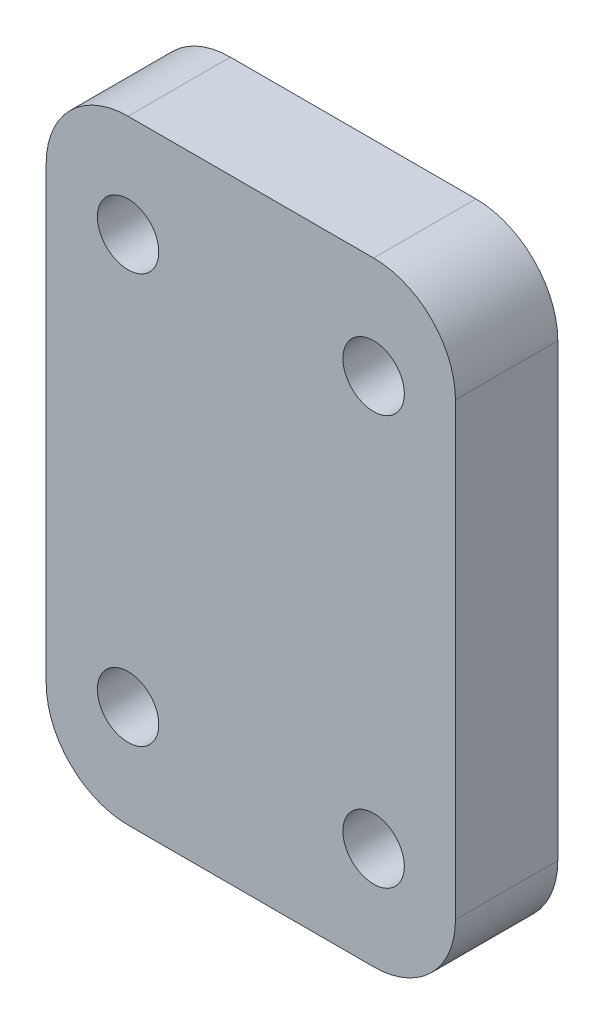
from build123d import *

# Parameters (mm, degrees)
SKETCH1_R           = 1.5
BOSS_EXTRUDE1_DEPTH = 5


with BuildPart() as part:
    # Sketch1 → Boss-Extrude1 (new body)
    with BuildSketch(Plane.XY):
        with BuildLine():
            Line((-6, 15), (6, 15))
            ThreePointArc((6, 15), (8.828427125, 13.828427125), (10, 11))
            Line((10, 11), (10, -11))
            ThreePointArc((10, -11), (8.828427125, -13.828427125), (6, -15))
            Line((6, -15), (-6, -15))
            ThreePointArc((-6, -15), (-8.828427125, -13.828427125), (-10, -11))
            Line((-10, -11), (-10, 11))
            ThreePointArc((-10, 11), (-8.828427125, 13.828427125), (-6, 15))
        make_face()
        with Locations((-6, 10)):
            Circle(SKETCH1_R, mode=Mode.SUBTRACT)
        with Locations((6, 10)):
            Circle(SKETCH1_R, mode=Mode.SUBTRACT)
        with Locations((-6, -10)):
            Circle(SKETCH1_R, mode=Mode.SUBTRACT)
        with Locations((6, -10)):
            Circle(SKETCH1_R, mode=Mode.SUBTRACT)
    extrude(amount=BOSS_EXTRUDE1_DEPTH)


solid = part.part
